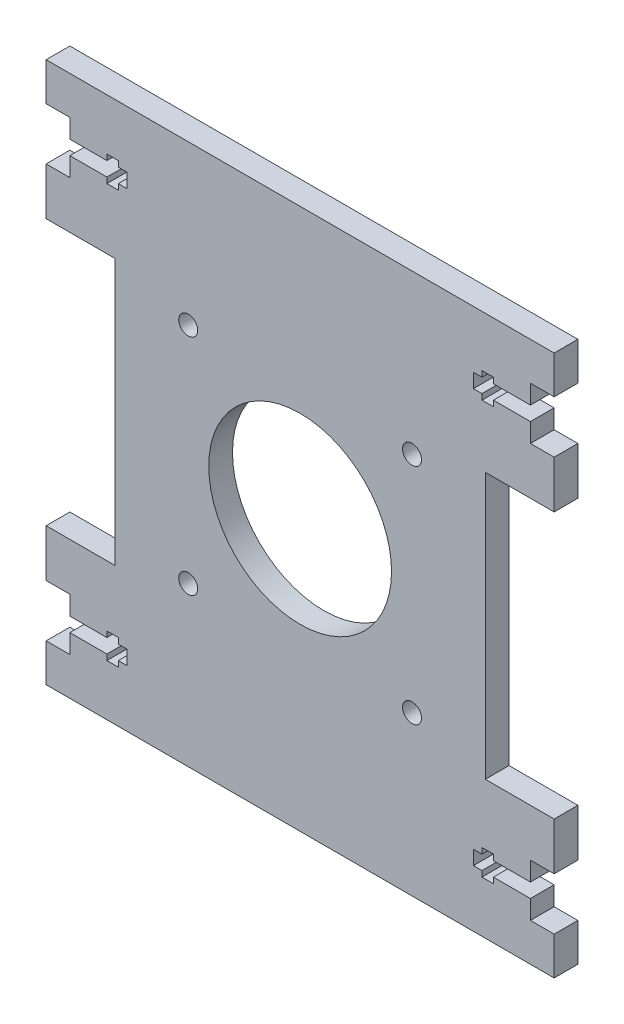
from build123d import *

# Parameters (mm, degrees)
MODEL_R                  = 2
MODEL_R_2                = 19.25
RESSALTO_EXTRUS_O1_DEPTH = 5


with BuildPart() as part:
    # Model → Ressalto-extrusão1 (new body)
    with BuildSketch(Plane.XY):
        Polygon((-87.499906276, 136.999930927), (-79.699992019, 136.999930927), (-79.699992019, 135.799931225), (-77.299992019, 135.799931225), (-77.299992019, 136.999930927), (-75.499992019, 136.999930927), (-75.499992019, 139.999946471), (-77.299992019, 139.999946471), (-77.299992019, 141.199946173), (-79.699992019, 141.199946173), (-79.699992019, 139.999946471), (-87.499906276, 139.999946471), (-87.499906276, 143.971527937), (-92.499906103, 143.971527937), (-92.499906103, 151.99992515), (14.500094446, 151.99992515), (14.500094446, 143.999926549), (9.500094619, 143.999926549), (9.500094619, 139.999946471), (1.700033295, 139.999946471), (1.700033295, 141.199946173), (-0.699966705, 141.199946173), (-0.699966705, 139.999946471), (-2.499966705, 139.999946471), (-2.499966705, 136.999930927), (-0.699966705, 136.999930927), (-0.699966705, 135.799931225), (1.700033295, 135.799931225), (1.700033295, 136.999930927), (9.500094619, 136.999930927), (9.500094619, 133.000010759), (14.500094446, 133.000010759), (14.500094446, 123.000010744), (3.1755e-05, 123.000010744), (3.1755e-05, 66.999892416), (14.500094446, 66.999892416), (14.500094446, 56.999892401), (9.500094619, 56.999892401), (9.500094619, 52.999972233), (1.700033295, 52.999972233), (1.700033295, 54.199971935), (-0.699966705, 54.199971935), (-0.699966705, 52.999972233), (-2.499966705, 52.999972233), (-2.499966705, 50.000008094), (-0.699966705, 50.000008094), (-0.699966705, 48.799928912), (1.700033295, 48.799928912), (1.700033295, 50.000008094), (9.500094619, 50.000008094), (9.500094619, 46.000008447), (14.500094446, 46.000008447), (14.500094446, 38.000009846), (-92.499906103, 38.000009846), (-92.499906103, 46.000008447), (-87.499906276, 46.000008447), (-87.499906276, 49.999928614), (-79.699992019, 49.999928614), (-79.699992019, 48.799928912), (-77.299992019, 48.799928912), (-77.299992019, 49.999928614), (-75.499992019, 49.999928614), (-75.499992019, 52.999972233), (-77.299992019, 52.999972233), (-77.299992019, 54.199971935), (-79.699992019, 54.199971935), (-79.699992019, 52.999972233), (-87.499906276, 52.999972233), (-87.499906276, 56.999892401), (-92.500404317, 56.999892401), (-92.500404317, 66.999892416), (-78.000001989, 66.999892416), (-78.000001989, 123.000010744), (-92.499906103, 123.000010744), (-92.499906103, 133.000010759), (-87.499906276, 133.000010759), align=None)
        with Locations((-62.569893888, 118.570002461)):
            Circle(MODEL_R, mode=Mode.SUBTRACT)
        with Locations((-15.429893888, 118.570002461)):
            Circle(MODEL_R, mode=Mode.SUBTRACT)
        with Locations((-62.569893888, 71.430002461)):
            Circle(MODEL_R, mode=Mode.SUBTRACT)
        with Locations((-15.429893888, 71.430002461)):
            Circle(MODEL_R, mode=Mode.SUBTRACT)
        with Locations((-38.999893888, 95.000002461)):
            Circle(MODEL_R_2, mode=Mode.SUBTRACT)
    extrude(amount=RESSALTO_EXTRUS_O1_DEPTH)


solid = part.part
